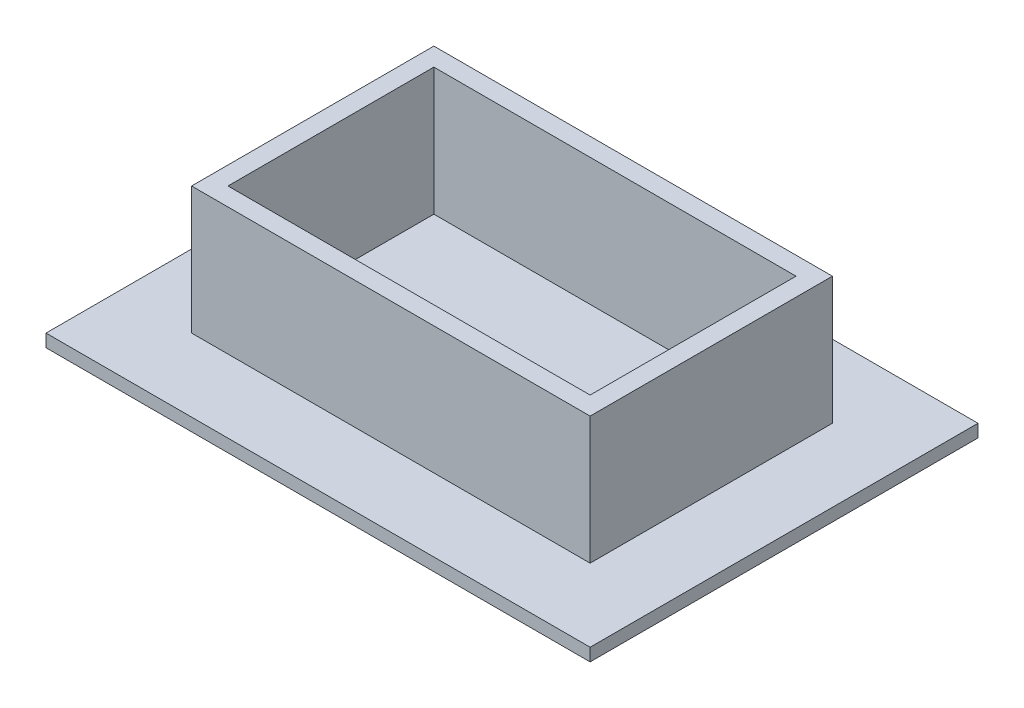
from build123d import *

# Parameters (mm, degrees)
SKETCH1_W           = 75.947601036
SKETCH1_H           = 54.14073695
BOSS_EXTRUDE1_DEPTH = 1.778
SKETCH2_W           = 55.627601036
SKETCH2_H           = 33.82073695
SKETCH2_W_2         = 50.547601036
SKETCH2_H_2         = 28.74073695
EXTRUDE_THIN1_DEPTH = 17.78


with BuildPart() as part:
    # Sketch1 → Boss-Extrude1 (new body)
    with BuildSketch(Plane(origin=(0, 0, 0), x_dir=(1, 0, 0), z_dir=(0, 1, 0))):
        Rectangle(SKETCH1_W, SKETCH1_H)
    extrude(amount=BOSS_EXTRUDE1_DEPTH)

    # Sketch2 → Extrude-Thin1 (add)
    with BuildSketch(Plane(origin=(0, 1.778, 0), x_dir=(1, 0, 0), z_dir=(0, 1, 0))):
        Rectangle(SKETCH2_W, SKETCH2_H)
        Rectangle(SKETCH2_W_2, SKETCH2_H_2, mode=Mode.SUBTRACT)
    extrude(amount=EXTRUDE_THIN1_DEPTH)


solid = part.part
